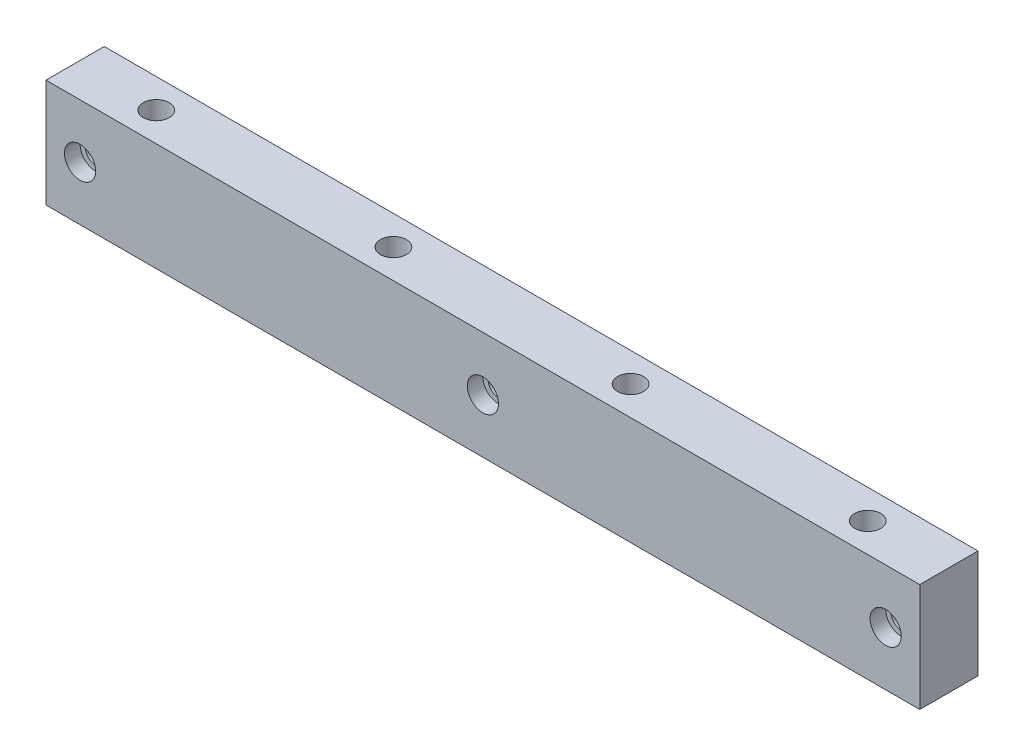
from build123d import *

# Parameters (mm, degrees)
SKETCH1_W           = 266.7
SKETCH1_H           = 17.78
SKETCH1_R           = 3.96875
BOSS_EXTRUDE1_DEPTH = 33.02
SKETCH2_R           = 3.175
CUT_EXTRUDE1_DEPTH  = 17.78
SKETCH3_R           = 4.7625
CUT_EXTRUDE2_DEPTH  = 4.7752


with BuildPart() as part:
    # Sketch1 → Boss-Extrude1 (new body)
    with BuildSketch(Plane(origin=(0, 0, 0), x_dir=(1, 0, 0), z_dir=(0, 1, 0))):
        with Locations((0, 8.89)):
            Rectangle(SKETCH1_W, SKETCH1_H)
        with Locations(Location((108.585, 8.89, 0), (0, 0, 270))):
            Circle(SKETCH1_R, mode=Mode.SUBTRACT)
        with Locations(Location((36.195, 8.89, 0), (0, 0, 270))):
            Circle(SKETCH1_R, mode=Mode.SUBTRACT)
        with Locations(Location((-36.195, 8.89, 0), (0, 0, 270))):
            Circle(SKETCH1_R, mode=Mode.SUBTRACT)
        with Locations(Location((-108.585, 8.89, 0), (0, 0, 270))):
            Circle(SKETCH1_R, mode=Mode.SUBTRACT)
    extrude(amount=-BOSS_EXTRUDE1_DEPTH)

    # Sketch2 → Cut-Extrude1 (cut)
    with BuildSketch(Plane.XY):
        with Locations((122.951875, -16.51)):
            Circle(SKETCH2_R)
        with Locations((0, -16.51)):
            Circle(SKETCH2_R)
        with Locations((-122.951875, -16.51)):
            Circle(SKETCH2_R)
    extrude(amount=-CUT_EXTRUDE1_DEPTH, mode=Mode.SUBTRACT)

    # Sketch3 → Cut-Extrude2 (cut)
    with BuildSketch(Plane.XY):
        with Locations((122.951875, -16.51)):
            Circle(SKETCH3_R)
        with Locations((0, -16.51)):
            Circle(SKETCH3_R)
        with Locations((-122.951875, -16.51)):
            Circle(SKETCH3_R)
    extrude(amount=-CUT_EXTRUDE2_DEPTH, mode=Mode.SUBTRACT)


solid = part.part
